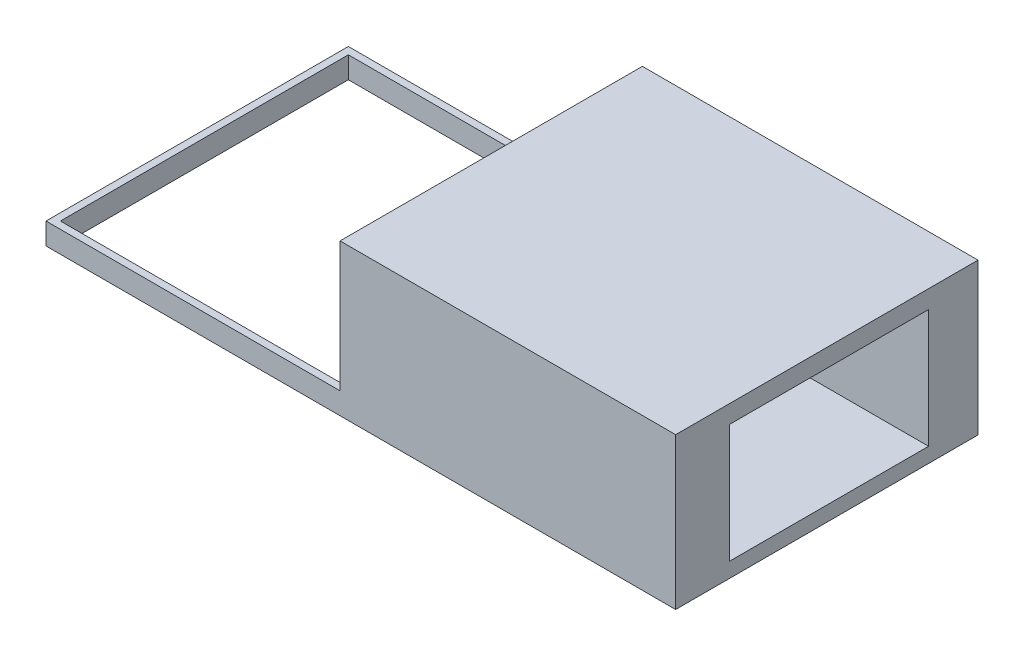
from build123d import *

# Parameters (mm, degrees)
CROQUIS1_W              = 62.313372472
CROQUIS1_H              = 41.924750101
CROQUIS1_W_2            = 60.313372472
CROQUIS1_H_2            = 39.924750101
SALIENTE_EXTRUIR1_DEPTH = 3
CROQUIS3_W              = 1.357711699
CROQUIS3_H              = 39.924750101
CROQUIS3_H_2            = 1
SALIENTE_EXTRUIR2_DEPTH = 18
CROQUIS4_R              = 2.5
CORTAR_EXTRUIR1_DEPTH   = 60.378567465
CROQUIS5_W              = 19.180578122
CROQUIS5_H              = 1.001020226
SALIENTE_EXTRUIR3_DEPTH = 40
CROQUIS6_W              = 27.585602981
CROQUIS6_H              = 16.425068323
CORTAR_EXTRUIR2_DEPTH   = 5
CROQUIS7_W              = 41.924750101
CROQUIS7_H              = 21
CROQUIS7_W_2            = 27.585602981
CROQUIS7_H_2            = 16.425068323
SALIENTE_EXTRUIR4_DEPTH = 25


with BuildPart() as part:
    # Croquis1 → Saliente-Extruir1 (new body)
    with BuildSketch(Plane(origin=(0, 0, 0), x_dir=(1, 0, 0), z_dir=(0, 1, 0))):
        with Locations((31.156686236, 16.749783587)):
            Rectangle(CROQUIS1_W, CROQUIS1_H)
        with Locations((31.156686236, 16.749783587)):
            Rectangle(CROQUIS1_W_2, CROQUIS1_H_2, mode=Mode.SUBTRACT)
    extrude(amount=SALIENTE_EXTRUIR1_DEPTH)

    # Croquis3 → Saliente-Extruir2 (add)
    with BuildSketch(Plane(origin=(0, 3, 0), x_dir=(1, 0, 0), z_dir=(0, 1, 0))):
        with Locations((41.453938501, 16.749783587)):
            Rectangle(CROQUIS3_W, CROQUIS3_H)
        Polygon((42.13279435, -3.212591464), (42.13279435, -4.212591464), (62.313372472, -4.212591464), (62.313372472, 37.712158637), (42.13279435, 37.712158637), (42.13279435, 36.712158637), (61.313372472, 36.712158637), (61.313372472, -3.212591464), align=None)
        with Locations((41.453938501, -3.712591464)):
            Rectangle(CROQUIS3_W, CROQUIS3_H_2)
        with Locations((41.453938501, 37.212158637)):
            Rectangle(CROQUIS3_W, CROQUIS3_H_2)
    extrude(amount=SALIENTE_EXTRUIR2_DEPTH)

    # Croquis4 → Cortar-Extruir1 (cut, through all)
    with BuildSketch(Plane.ZY.offset(-40.775082651)):
        with Locations((-17.242511343, 11.542387771)):
            Circle(CROQUIS4_R)
    extrude(amount=-CORTAR_EXTRUIR1_DEPTH, mode=Mode.SUBTRACT)

    # Croquis5 → Saliente-Extruir3 (add)
    with BuildSketch(Plane.XY.offset(-36.712158637)):
        with Locations((51.723083411, 20.499489887)):
            Rectangle(CROQUIS5_W, CROQUIS5_H)
    extrude(amount=SALIENTE_EXTRUIR3_DEPTH)

    # Croquis6 → Cortar-Extruir2 (cut)
    with BuildSketch(Plane(origin=(62.313372472, 0, 0), x_dir=(0, 0, -1), z_dir=(1, 0, 0))):
        with Locations((17.064754598, 10.282718264)):
            Rectangle(CROQUIS6_W, CROQUIS6_H)
    extrude(amount=-CORTAR_EXTRUIR2_DEPTH, mode=Mode.SUBTRACT)

    # Croquis7 → Saliente-Extruir4 (add)
    with BuildSketch(Plane(origin=(62.313372472, 0, 0), x_dir=(0, 0, -1), z_dir=(1, 0, 0))):
        with Locations((16.749783587, 10.5)):
            Rectangle(CROQUIS7_W, CROQUIS7_H)
        with Locations((17.064754598, 10.282718264)):
            Rectangle(CROQUIS7_W_2, CROQUIS7_H_2, mode=Mode.SUBTRACT)
    extrude(amount=SALIENTE_EXTRUIR4_DEPTH)


solid = part.part
